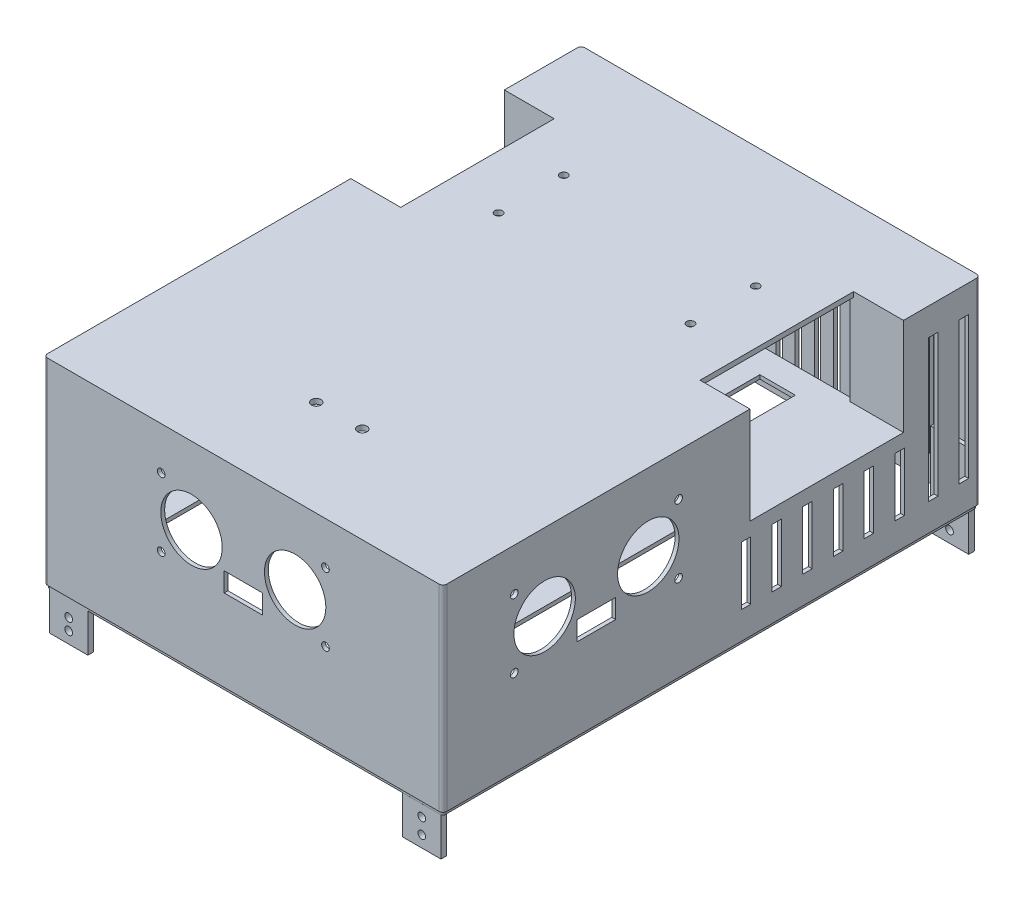
from build123d import *

# Parameters (mm, degrees)
BOSS_EXTRUDE1_DEPTH      = 1.3
SKETCH2_R                = 1
CUT_EXTRUDE3_DEPTH       = 88.210607153
BOSS_EXTRUDE3_DEPTH      = 50
CUT_EXTRUDE5_DEPTH       = 135.96666255
CUT_EXTRUDE5_DEPTH_BACK  = 135.96666255
SKETCH5_R                = 8
SKETCH5_R_2              = 1
SKETCH7_R                = 8
SKETCH7_R_2              = 1
CUT_EXTRUDE6_DEPTH       = 31.3
SKETCH8_R                = 1.25
CUT_EXTRUDE10_DEPTH      = 102.17158692
SKETCH10_W               = 40
SKETCH10_H               = 24
CUT_EXTRUDE11_DEPTH      = 126.223799655
SKETCH11_W               = 40
SKETCH11_H               = 1
BOSS_EXTRUDE4_DEPTH      = 13
SKETCH12_W               = 40
SKETCH12_H               = 25
CUT_EXTRUDE12_DEPTH      = 126.223799655
SKETCH13_W               = 1
SKETCH13_H               = 40
BOSS_EXTRUDE5_DEPTH      = 25
SKETCH14_W               = 40
SKETCH14_H               = 1
BOSS_EXTRUDE6_DEPTH      = 13
SKETCH15_W               = 1
SKETCH15_H               = 40
BOSS_EXTRUDE8_DEPTH      = 25
CUT_EXTRUDE15_REACH      = 109.722
SKETCH17_W               = 13
SKETCH17_H               = 25
CUT_EXTRUDE16_REACH      = 142.014
SKETCH18_W               = 13
SKETCH18_H               = 25
CUT_EXTRUDE17_REACH      = 142.014
SKETCH19_W               = 13
SKETCH19_H               = 25
CUT_EXTRUDE18_REACH      = 109.722
SKETCH20_W               = 13
SKETCH20_H               = 25
BOSS_EXTRUDE9_REACH      = 126.499
CUT_EXTRUDE19_REACH      = 93.081
SKETCH23_W               = 9.250018893
SKETCH23_H               = 28.661106986
CUT_EXTRUDE20_REACH      = 102.519
SKETCH25_W               = 9.250018894
SKETCH25_H               = 28.661106986
FILLET2_R                = 1
SKETCH33_W               = 20
SKETCH33_H               = 1
BOSS_EXTRUDE12_DEPTH     = 81.3
SKETCH35_W               = 1.628868949
SKETCH35_H               = 40.019006724
CUT_EXTRUDE22_DEPTH      = 5
SKETCH36_W               = 2.454172854
SKETCH36_H               = 37.00153136
CUT_EXTRUDE23_DEPTH      = 135.96666255
SKETCH34_W               = 102
SKETCH34_H               = 138
BOSS_EXTRUDE13_DEPTH     = 1
SKETCH39_W               = 10
SKETCH39_H               = 14
BOSS_EXTRUDE14_DEPTH     = 1
SKETCH40_W               = 10
SKETCH40_H               = 1.5
BOSS_EXTRUDE15_DEPTH     = 10
SKETCH42_W               = 10
SKETCH42_H               = 14
BOSS_EXTRUDE16_DEPTH     = 1
BOSS_EXTRUDE17_DEPTH     = 10
SKETCH45_R               = 1
CUT_EXTRUDE24_DEPTH      = 161.888936848
SKETCH47_W               = 10
SKETCH47_H               = 14
BOSS_EXTRUDE18_DEPTH     = 1
SKETCH48_W               = 10
SKETCH48_H               = 1.5
BOSS_EXTRUDE19_DEPTH     = 10
SKETCH50_W               = 10
SKETCH50_H               = 14
BOSS_EXTRUDE20_DEPTH     = 1
SKETCH51_W               = 10
SKETCH51_H               = 1.5
BOSS_EXTRUDE21_DEPTH     = 10
CUT_EXTRUDE25_DEPTH      = 160.590099944
CUT_EXTRUDE25_DEPTH_BACK = 160.590099944
SKETCH49_R               = 1


with BuildPart() as part:
    # Sketch1 → Boss-Extrude1 (new body)
    with BuildSketch(Plane(origin=(0, 0, 0), x_dir=(1, 0, 0), z_dir=(0, 1, 0))):
        Polygon((-52, 70), (52, 70), (52, 50), (39, 50), (39, 10), (52, 10), (52, -70), (-52, -70), (-52, 10), (-39, 10), (-39, 50), (-52, 50), align=None)
    extrude(amount=BOSS_EXTRUDE1_DEPTH)

    # Sketch2 → Cut-Extrude3 (cut, through all)
    with BuildSketch(Plane(origin=(0, 1.3, 0), x_dir=(1, 0, 0), z_dir=(0, 1, 0))):
        with Locations(Location((-25, 38.5, 0), (0, 0, 270))):
            Circle(SKETCH2_R)
        with Locations(Location((-25, 21.5, 0), (0, 0, 270))):
            Circle(SKETCH2_R)
        with Locations(Location((25, 38.5, 0), (0, 0, 270))):
            Circle(SKETCH2_R)
        with Locations(Location((25, 21.5, 0), (0, 0, 270))):
            Circle(SKETCH2_R)
    extrude(amount=-CUT_EXTRUDE3_DEPTH, mode=Mode.SUBTRACT)

    # Sketch3 → Boss-Extrude3 (add)
    with BuildSketch(Plane.XZ):
        Polygon((52, -10), (52, 70), (-52, 70), (-52, -10), (-39, -10), (-39, -50), (-52, -50), (-52, -70), (52, -70), (52, -50), (39, -50), (39, -10), align=None)
        Polygon((51, -9), (51, 69), (-51, 69), (-51, -9), (-38, -9), (-38, -51), (-51, -51), (-51, -69), (51, -69), (51, -51), (38, -51), (38, -9), align=None, mode=Mode.SUBTRACT)
    extrude(amount=BOSS_EXTRUDE3_DEPTH)

    # Sketch5 → Cut-Extrude5 (cut, two sides: drawn at the far end of the back side and taken through both)
    with BuildSketch(Plane.ZY.offset(52).offset(-CUT_EXTRUDE5_DEPTH_BACK)):
        with Locations(Location((16.5, -18.7, 0), (0, 0, 180))):
            Circle(SKETCH5_R)
        with Locations(Location((43.5, -18.7, 0), (0, 0, 180))):
            Circle(SKETCH5_R)
        with Locations(Location((8.6, -27.6, 0), (0, 0, 180))):
            Circle(SKETCH5_R_2)
        with Locations(Location((51.4, -27.6, 0), (0, 0, 180))):
            Circle(SKETCH5_R_2)
        with Locations(Location((8.6, -9.8, 0), (0, 0, 180))):
            Circle(SKETCH5_R_2)
        with Locations(Location((51.4, -9.8, 0), (0, 0, 180))):
            Circle(SKETCH5_R_2)
        Polygon((30, -28.7), (35, -28.7), (35, -23.7), (25, -23.7), (25, -28.7), align=None)
    extrude(amount=CUT_EXTRUDE5_DEPTH + CUT_EXTRUDE5_DEPTH_BACK, mode=Mode.SUBTRACT)

    # Sketch7 → Cut-Extrude6 (cut)
    with BuildSketch(Plane.XY.offset(70)):
        with Locations((-13.5, -18.7)):
            Circle(SKETCH7_R)
        with Locations((13.5, -18.7)):
            Circle(SKETCH7_R)
        with Locations((-21.4, -27.6)):
            Circle(SKETCH7_R_2)
        with Locations(Location((21.4, -27.6, 0), (0, 0, 180))):
            Circle(SKETCH7_R_2)
        with Locations((21.4, -9.8)):
            Circle(SKETCH7_R_2)
        with Locations(Location((-21.4, -9.8, 0), (0, 0, 180))):
            Circle(SKETCH7_R_2)
        Polygon((0, -28.7), (5, -28.7), (5, -23.7), (-5, -23.7), (-5, -28.7), align=None)
    extrude(amount=-CUT_EXTRUDE6_DEPTH, mode=Mode.SUBTRACT)

    # Sketch8 → Cut-Extrude10 (cut, through all)
    with BuildSketch(Plane(origin=(0, 1.3, 0), x_dir=(1, 0, 0), z_dir=(0, 1, 0))):
        with Locations(Location((-6, -45, 0), (0, 0, 270))):
            Circle(SKETCH8_R)
        with Locations(Location((6, -45, 0), (0, 0, 270))):
            Circle(SKETCH8_R)
    extrude(amount=-CUT_EXTRUDE10_DEPTH, mode=Mode.SUBTRACT)

    # Sketch10 → Cut-Extrude11 (cut, through all)
    with BuildSketch(Plane(origin=(39, 0, 0), x_dir=(0, 0, -1), z_dir=(1, 0, 0))):
        with Locations((30, -12)):
            Rectangle(SKETCH10_W, SKETCH10_H)
    extrude(amount=-CUT_EXTRUDE11_DEPTH, mode=Mode.SUBTRACT)

    # Sketch11 → Boss-Extrude4 (add, through all)
    with BuildSketch(Plane.ZY.offset(39)):
        with Locations((-30, -24.5)):
            Rectangle(SKETCH11_W, SKETCH11_H)
    extrude(amount=BOSS_EXTRUDE4_DEPTH)

    # Sketch12 → Cut-Extrude12 (cut, through all)
    with BuildSketch(Plane.ZY.offset(39)):
        with Locations((-30, -37.5)):
            Rectangle(SKETCH12_W, SKETCH12_H)
    extrude(amount=-CUT_EXTRUDE12_DEPTH, mode=Mode.SUBTRACT)

    # Sketch13 → Boss-Extrude5 (add, through all)
    with BuildSketch(Plane.XZ.offset(25)):
        with Locations((-51.5, -30)):
            Rectangle(SKETCH13_W, SKETCH13_H)
    extrude(amount=BOSS_EXTRUDE5_DEPTH)

    # Sketch14 → Boss-Extrude6 (add, through all)
    with BuildSketch(Plane(origin=(39, 0, 0), x_dir=(0, 0, -1), z_dir=(1, 0, 0))):
        with Locations((30, -24.5)):
            Rectangle(SKETCH14_W, SKETCH14_H)
    extrude(amount=BOSS_EXTRUDE6_DEPTH)

    # Sketch15 → Boss-Extrude8 (add, through all)
    with BuildSketch(Plane.XZ.offset(25)):
        with Locations((51.5, -30)):
            Rectangle(SKETCH15_W, SKETCH15_H)
    extrude(amount=BOSS_EXTRUDE8_DEPTH)

    # Sketch17 → Cut-Extrude15 (cut, up to next)
    with BuildSketch(Plane(origin=(0, 0, -10), x_dir=(-1, 0, 0), z_dir=(0, 0, -1)), mode=Mode.PRIVATE) as cut_extrude15_sk1:
        with Locations((44.5, -37.5)):
            Rectangle(SKETCH17_W, SKETCH17_H)
    cut_extrude15_tool1 = extrude(cut_extrude15_sk1.sketch, amount=-CUT_EXTRUDE15_REACH, mode=Mode.PRIVATE) & part.part
    add(cut_extrude15_tool1.solids().sort_by_distance((-44.5, -37.5, -10))[0], mode=Mode.SUBTRACT)

    # Sketch18 → Cut-Extrude16 (cut, up to next)
    with BuildSketch(Plane.XY.offset(-50), mode=Mode.PRIVATE) as cut_extrude16_sk1:
        with Locations((-44.5, -37.5)):
            Rectangle(SKETCH18_W, SKETCH18_H)
    cut_extrude16_tool1 = extrude(cut_extrude16_sk1.sketch, amount=-CUT_EXTRUDE16_REACH, mode=Mode.PRIVATE) & part.part
    add(cut_extrude16_tool1.solids().sort_by_distance((-44.5, -37.5, -50))[0], mode=Mode.SUBTRACT)

    # Sketch19 → Cut-Extrude17 (cut, up to next)
    with BuildSketch(Plane.XY.offset(-50), mode=Mode.PRIVATE) as cut_extrude17_sk1:
        with Locations((44.5, -37.5)):
            Rectangle(SKETCH19_W, SKETCH19_H)
    cut_extrude17_tool1 = extrude(cut_extrude17_sk1.sketch, amount=-CUT_EXTRUDE17_REACH, mode=Mode.PRIVATE) & part.part
    add(cut_extrude17_tool1.solids().sort_by_distance((44.5, -37.5, -50))[0], mode=Mode.SUBTRACT)

    # Sketch20 → Cut-Extrude18 (cut, up to next)
    with BuildSketch(Plane(origin=(0, 0, -10), x_dir=(-1, 0, 0), z_dir=(0, 0, -1)), mode=Mode.PRIVATE) as cut_extrude18_sk1:
        with Locations((-44.5, -37.5)):
            Rectangle(SKETCH20_W, SKETCH20_H)
    cut_extrude18_tool1 = extrude(cut_extrude18_sk1.sketch, amount=-CUT_EXTRUDE18_REACH, mode=Mode.PRIVATE) & part.part
    add(cut_extrude18_tool1.solids().sort_by_distance((44.5, -37.5, -10))[0], mode=Mode.SUBTRACT)

    # Sketch21 → Boss-Extrude9 (add, up to next)
    with BuildSketch(Plane.ZY.offset(-38), mode=Mode.PRIVATE) as boss_extrude9_sk1:
        Polygon((-51, -25), (-9, -25), (-9, -24.152242626), (-9, -23.983631609), (-10, -24), (-51, -24), align=None)
    boss_extrude9_tool1 = extrude(boss_extrude9_sk1.sketch, amount=BOSS_EXTRUDE9_REACH, mode=Mode.PRIVATE) - part.part
    add(boss_extrude9_tool1.solids().sort_by_distance((38, -24.499902, -29.995974))[0])

    # Sketch23 → Cut-Extrude19 (cut, up to next)
    with BuildSketch(Plane.XZ.offset(25), mode=Mode.PRIVATE) as cut_extrude19_sk1:
        with Locations((24.861785537, -30)):
            Rectangle(SKETCH23_W, SKETCH23_H)
    cut_extrude19_tool1 = extrude(cut_extrude19_sk1.sketch, amount=-CUT_EXTRUDE19_REACH, mode=Mode.PRIVATE) & part.part
    add(cut_extrude19_tool1.solids().sort_by_distance((24.861786, -25, -30))[0], mode=Mode.SUBTRACT)

    # Sketch25 → Cut-Extrude20 (cut, up to next)
    with BuildSketch(Plane.XZ, mode=Mode.PRIVATE) as cut_extrude20_sk1:
        with Locations((-24.994153909, -30)):
            Rectangle(SKETCH25_W, SKETCH25_H)
    cut_extrude20_tool1 = extrude(cut_extrude20_sk1.sketch, amount=CUT_EXTRUDE20_REACH, mode=Mode.PRIVATE) & part.part
    add(cut_extrude20_tool1.solids().sort_by_distance((-24.994154, 0, -30))[0], mode=Mode.SUBTRACT)

    # Fillet2
    fillet2_edges = [part.edges().sort_by_distance(p)[0] for p in [
        (52, -24.35, 70),
        (-52, -24.35, 70),
        (-52, -24.35, -70),
        (52, -24.35, -70),
    ]]
    fillet(fillet2_edges, radius=FILLET2_R)

    # Sketch33 → Boss-Extrude12 (add)
    with BuildSketch(Plane(origin=(0, 0, 69), x_dir=(-1, 0, 0), z_dir=(0, 0, -1))):
        with Locations((-34.5, -24.5)):
            Rectangle(SKETCH33_W, SKETCH33_H)
        with Locations((34.5, -24.5)):
            Rectangle(SKETCH33_W, SKETCH33_H)
    extrude(amount=BOSS_EXTRUDE12_DEPTH)

    # Sketch35 → Cut-Extrude22 (cut)
    with BuildSketch(Plane(origin=(0, 0, -70), x_dir=(-1, 0, 0), z_dir=(0, 0, -1))):
        with Locations((44.394895558, -24.35)):
            Rectangle(SKETCH35_W, SKETCH35_H)
        with Locations((39.394895558, -24.35)):
            Rectangle(SKETCH35_W, SKETCH35_H)
        with Locations((34.394895558, -24.35)):
            Rectangle(SKETCH35_W, SKETCH35_H)
        with Locations((29.394895557, -24.35)):
            Rectangle(SKETCH35_W, SKETCH35_H)
        with Locations((24.394895557, -24.35)):
            Rectangle(SKETCH35_W, SKETCH35_H)
        with Locations((19.394895557, -24.35)):
            Rectangle(SKETCH35_W, SKETCH35_H)
        with Locations((14.394895557, -24.35)):
            Rectangle(SKETCH35_W, SKETCH35_H)
        with Locations((9.394895557, -24.35)):
            Rectangle(SKETCH35_W, SKETCH35_H)
        with Locations((4.394895557, -24.35)):
            Rectangle(SKETCH35_W, SKETCH35_H)
        with Locations((-0.605104443, -24.35)):
            Rectangle(SKETCH35_W, SKETCH35_H)
        with Locations((-5.605104443, -24.35)):
            Rectangle(SKETCH35_W, SKETCH35_H)
        with Locations((-10.605104443, -24.35)):
            Rectangle(SKETCH35_W, SKETCH35_H)
        with Locations((-15.605104443, -24.35)):
            Rectangle(SKETCH35_W, SKETCH35_H)
        with Locations((-20.605104443, -24.35)):
            Rectangle(SKETCH35_W, SKETCH35_H)
        with Locations((-25.605104443, -24.35)):
            Rectangle(SKETCH35_W, SKETCH35_H)
        with Locations((-30.605104443, -24.35)):
            Rectangle(SKETCH35_W, SKETCH35_H)
        with Locations((-35.605104443, -24.35)):
            Rectangle(SKETCH35_W, SKETCH35_H)
        with Locations((-40.605104443, -24.35)):
            Rectangle(SKETCH35_W, SKETCH35_H)
        with Locations((-45.605104443, -24.35)):
            Rectangle(SKETCH35_W, SKETCH35_H)
    extrude(amount=-CUT_EXTRUDE22_DEPTH, mode=Mode.SUBTRACT)

    # Sketch36 → Cut-Extrude23 (cut, through all)
    with BuildSketch(Plane(origin=(52, 0, 0), x_dir=(0, 0, -1), z_dir=(1, 0, 0))):
        with Locations((65.751063299, -24.35)):
            Rectangle(SKETCH36_W, SKETCH36_H)
        with Locations((57.751063299, -24.35)):
            Rectangle(SKETCH36_W, SKETCH36_H)
        Polygon((50.20146268, -42.85076568), (50.20146268, -31.306081945), (50.20146268, -27.618145494), (47.747289827, -27.618145494), (47.747289827, -42.85076568), align=None)
        Polygon((42.20146268, -42.85076568), (42.20146268, -31.306081945), (42.20146268, -27.618145494), (39.747289827, -27.618145494), (39.747289827, -42.85076568), align=None)
        Polygon((34.20146268, -42.85076568), (34.20146268, -31.306081945), (34.20146268, -27.618145494), (31.747289827, -27.618145494), (31.747289827, -42.85076568), align=None)
        Polygon((26.20146268, -42.85076568), (26.20146268, -31.306081945), (26.20146268, -27.618145494), (23.747289827, -27.618145494), (23.747289827, -42.85076568), align=None)
        Polygon((18.20146268, -42.85076568), (18.20146268, -31.306081945), (18.20146268, -27.618145494), (15.747289827, -27.618145494), (15.747289827, -42.85076568), align=None)
        Polygon((10.20146268, -42.85076568), (10.20146268, -31.306081945), (10.20146268, -27.618145494), (7.747289827, -27.618145494), (7.747289827, -42.85076568), align=None)
    extrude(amount=-CUT_EXTRUDE23_DEPTH, mode=Mode.SUBTRACT)

    # Sketch34 → Boss-Extrude13 (add)
    with BuildSketch(Plane.XZ.offset(50)):
        with BuildLine():
            Line((-51, -69.5), (51, -69.5))
            ThreePointArc((51, -69.5), (51.353553391, -69.353553391), (51.5, -69))
            Line((51.5, -69), (51.5, 69))
            ThreePointArc((51.5, 69), (51.353553391, 69.353553391), (51, 69.5))
            Line((51, 69.5), (-51, 69.5))
            ThreePointArc((-51, 69.5), (-51.353553391, 69.353553391), (-51.5, 69))
            Line((-51.5, 69), (-51.5, -69))
            ThreePointArc((-51.5, -69), (-51.353553391, -69.353553391), (-51, -69.5))
        make_face()
        Rectangle(SKETCH34_W, SKETCH34_H, mode=Mode.SUBTRACT)
    extrude(amount=BOSS_EXTRUDE13_DEPTH)

    # Sketch39 → Boss-Extrude14 (add)
    with BuildSketch(Plane.XY.offset(-69)):
        with Locations((46, -44)):
            Rectangle(SKETCH39_W, SKETCH39_H)
    extrude(amount=BOSS_EXTRUDE14_DEPTH)

    # Sketch40 → Boss-Extrude15 (add)
    with BuildSketch(Plane.XZ.offset(51)):
        with Locations((46, -68.75)):
            Rectangle(SKETCH40_W, SKETCH40_H)
    extrude(amount=BOSS_EXTRUDE15_DEPTH)

    # Sketch42 → Boss-Extrude16 (add)
    with BuildSketch(Plane(origin=(0, 0, 69), x_dir=(-1, 0, 0), z_dir=(0, 0, -1))):
        with Locations((-46, -44)):
            Rectangle(SKETCH42_W, SKETCH42_H)
    extrude(amount=BOSS_EXTRUDE16_DEPTH)

    # Sketch43 → Boss-Extrude17 (add)
    with BuildSketch(Plane.XZ.offset(51)):
        Polygon((41, 68), (41, 69.508966991), (51, 69.5), (50.998654951, 68), align=None)
    extrude(amount=BOSS_EXTRUDE17_DEPTH)

    # Sketch45 → Cut-Extrude24 (cut, through all)
    with BuildSketch(Plane(origin=(0, 0, -69.5), x_dir=(-1, 0, 0), z_dir=(0, 0, -1))):
        with Locations(Location((-46, -54, 0), (0, 0, 180))):
            Circle(SKETCH45_R)
        with Locations(Location((-46, -58, 0), (0, 0, 180))):
            Circle(SKETCH45_R)
    extrude(amount=-CUT_EXTRUDE24_DEPTH, mode=Mode.SUBTRACT)

    # Sketch47 → Boss-Extrude18 (add)
    with BuildSketch(Plane.XY.offset(-69)):
        with Locations((-46, -44)):
            Rectangle(SKETCH47_W, SKETCH47_H)
    extrude(amount=BOSS_EXTRUDE18_DEPTH)

    # Sketch48 → Boss-Extrude19 (add)
    with BuildSketch(Plane.XZ.offset(51)):
        with Locations((-46, -68.75)):
            Rectangle(SKETCH48_W, SKETCH48_H)
    extrude(amount=BOSS_EXTRUDE19_DEPTH)

    # Sketch50 → Boss-Extrude20 (add)
    with BuildSketch(Plane(origin=(0, 0, 69), x_dir=(-1, 0, 0), z_dir=(0, 0, -1))):
        with Locations((46, -44)):
            Rectangle(SKETCH50_W, SKETCH50_H)
    extrude(amount=BOSS_EXTRUDE20_DEPTH)

    # Sketch51 → Boss-Extrude21 (add)
    with BuildSketch(Plane.XZ.offset(51)):
        with Locations((-46, 68.75)):
            Rectangle(SKETCH51_W, SKETCH51_H)
    extrude(amount=BOSS_EXTRUDE21_DEPTH)

    # Sketch49 → Cut-Extrude25 (cut, two sides: drawn at the far end of the back side and taken through both)
    with BuildSketch(Plane.XY.offset(-68).offset(-CUT_EXTRUDE25_DEPTH_BACK)):
        with Locations(Location((-46, -55, 0), (0, 0, 180))):
            Circle(SKETCH49_R)
        with Locations(Location((-46, -58, 0), (0, 0, 180))):
            Circle(SKETCH49_R)
    extrude(amount=CUT_EXTRUDE25_DEPTH + CUT_EXTRUDE25_DEPTH_BACK, mode=Mode.SUBTRACT)


solid = part.part
